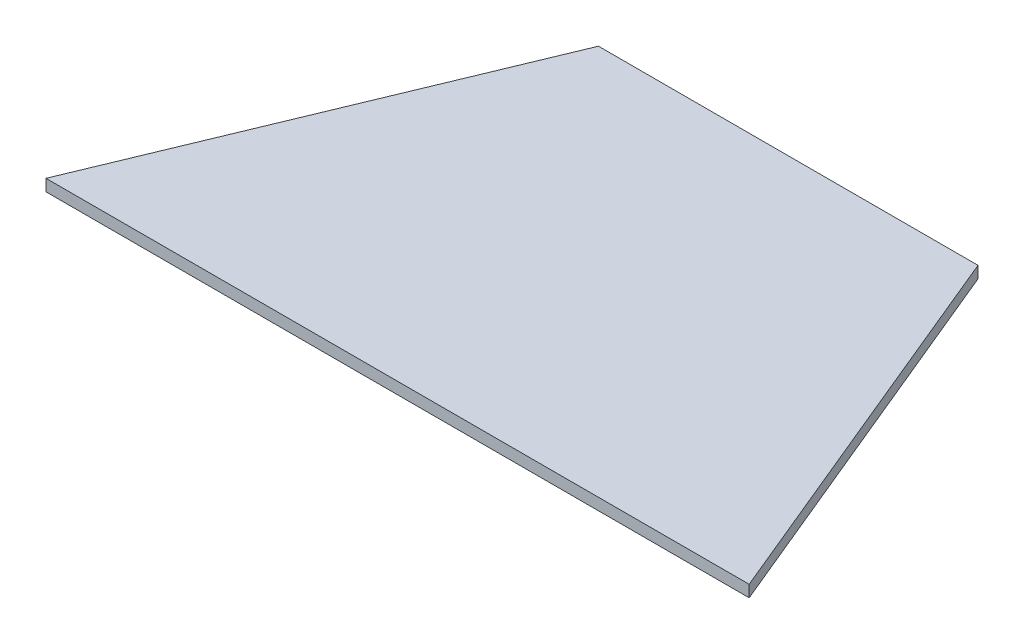
from build123d import *

# Parameters (mm, degrees)
BOSS_EXTRUDE1_DEPTH = 3


with BuildPart() as part:
    # Sketch1 → Boss-Extrude1 (new body)
    with BuildSketch(Plane(origin=(0, 0, 0), x_dir=(1, 0, 0), z_dir=(0, 1, 0))):
        Polygon((0, 0), (180, 0), (138.578643763, 100), (41.421356237, 100), align=None)
    extrude(amount=BOSS_EXTRUDE1_DEPTH)


solid = part.part
